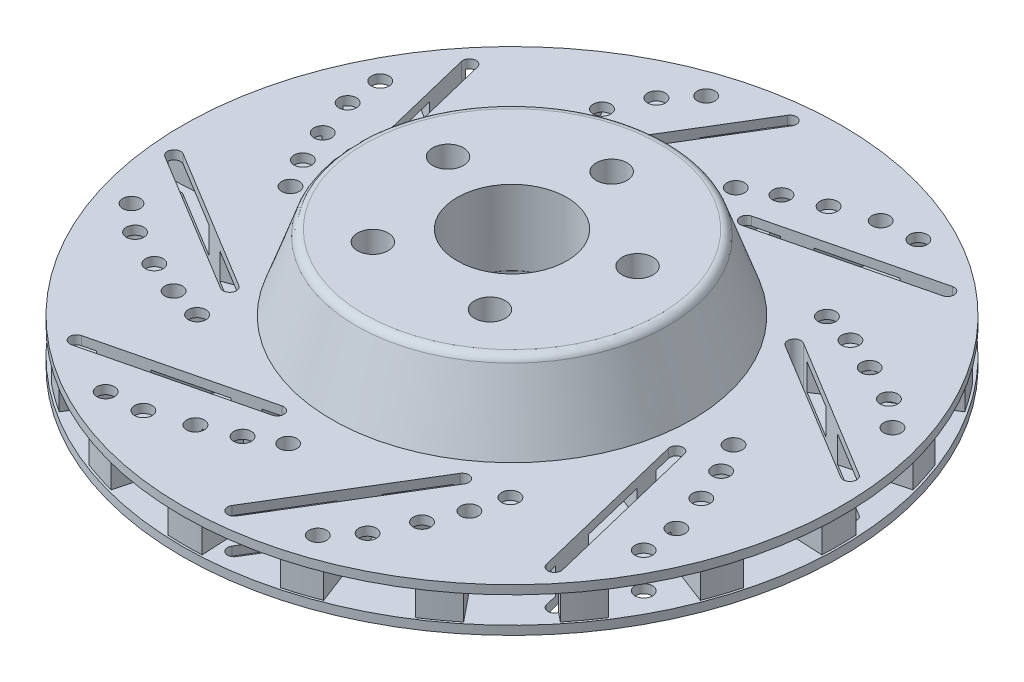
from build123d import *

# Parameters (mm, degrees)
SKETCH1_R               = 150
BOSS_EXTRUDE1_DEPTH     = 4
BOSS_EXTRUDE3_DEPTH     = 12
SKETCH4_R               = 150
BOSS_EXTRUDE4_DEPTH     = 4
FILLET1_R               = 4
SKETCH6_R               = 25
CUT_EXTRUDE1_DEPTH      = 219.919136573
SKETCH7_R               = 7
CUT_EXTRUDE2_DEPTH      = 31
CUT_EXTRUDE3_DEPTH      = 215.853531572
CUT_EXTRUDE3_DEPTH_BACK = 215.853531572
SKETCH9_R               = 4


with BuildPart() as part:
    # Sketch1 → Boss-Extrude1 (new body)
    with BuildSketch(Plane(origin=(0, 0, 0), x_dir=(1, 0, 0), z_dir=(0, 1, 0))):
        with Locations(Location((0, 0, 0), (0, 0, 270))):
            Circle(SKETCH1_R)
    extrude(amount=BOSS_EXTRUDE1_DEPTH)

    # Sketch2 → Boss-Extrude3 (add)
    with BuildSketch(Plane(origin=(0, 4, 0), x_dir=(1, 0, 0), z_dir=(0, 1, 0))):
        with BuildLine():
            Line((-4.291548412, 81.88762185), (-7.79805748, 148.795800678))
            ThreePointArc((-7.79805748, 148.795800678), (0, 149), (7.79805748, 148.795800678))
            Line((7.79805748, 148.795800678), (4.291548412, 81.88762185))
            ThreePointArc((4.291548412, 81.88762185), (0, 82), (-4.291548412, 81.88762185))
        make_face()
        with BuildLine():
            Line((21.223161698, 79.205917756), (38.56403772, 143.922948117))
            ThreePointArc((38.56403772, 143.922948117), (46.043532162, 141.707420928), (53.396824482, 139.103483548))
            Line((53.396824482, 139.103483548), (29.386171863, 76.553594973))
            ThreePointArc((29.386171863, 76.553594973), (25.339393539, 77.986634336), (21.223161698, 79.205917756))
        make_face()
        with BuildLine():
            Line((44.660400871, 68.770986572), (81.151216217, 124.961914624))
            ThreePointArc((81.151216217, 124.961914624), (87.580002592, 120.543532162), (93.768738266, 115.794748257))
            Line((93.768738266, 115.794748257), (51.604272066, 63.725968839))
            ThreePointArc((51.604272066, 63.725968839), (48.198390688, 66.339393539), (44.660400871, 68.770986572))
        make_face()
        with BuildLine():
            Line((63.725968839, 51.604272066), (115.794748257, 93.768738266))
            ThreePointArc((115.794748257, 93.768738266), (120.543532162, 87.580002592), (124.961914624, 81.151216217))
            Line((124.961914624, 81.151216217), (68.770986572, 44.660400871))
            ThreePointArc((68.770986572, 44.660400871), (66.339393539, 48.198390688), (63.725968839, 51.604272066))
        make_face()
        with BuildLine():
            Line((76.553594973, 29.386171863), (139.103483548, 53.396824482))
            ThreePointArc((139.103483548, 53.396824482), (141.707420928, 46.043532162), (143.922948117, 38.56403772))
            Line((143.922948117, 38.56403772), (79.205917756, 21.223161698))
            ThreePointArc((79.205917756, 21.223161698), (77.986634336, 25.339393539), (76.553594973, 29.386171863))
        make_face()
        with BuildLine():
            Line((81.88762185, 4.291548412), (148.795800678, 7.79805748))
            ThreePointArc((148.795800678, 7.79805748), (149, 0), (148.795800678, -7.79805748))
            Line((148.795800678, -7.79805748), (81.88762185, -4.291548412))
            ThreePointArc((81.88762185, -4.291548412), (82, 0), (81.88762185, 4.291548412))
        make_face()
        with BuildLine():
            Line((79.205917756, -21.223161698), (143.922948117, -38.56403772))
            ThreePointArc((143.922948117, -38.56403772), (141.707420928, -46.043532162), (139.103483548, -53.396824482))
            Line((139.103483548, -53.396824482), (76.553594973, -29.386171863))
            ThreePointArc((76.553594973, -29.386171863), (77.986634336, -25.339393539), (79.205917756, -21.223161698))
        make_face()
        with BuildLine():
            Line((68.770986572, -44.660400871), (124.961914624, -81.151216217))
            ThreePointArc((124.961914624, -81.151216217), (120.543532162, -87.580002592), (115.794748257, -93.768738266))
            Line((115.794748257, -93.768738266), (63.725968839, -51.604272066))
            ThreePointArc((63.725968839, -51.604272066), (66.339393539, -48.198390688), (68.770986572, -44.660400871))
        make_face()
        with BuildLine():
            Line((51.604272066, -63.725968839), (93.768738266, -115.794748257))
            ThreePointArc((93.768738266, -115.794748257), (87.580002592, -120.543532162), (81.151216217, -124.961914624))
            Line((81.151216217, -124.961914624), (44.660400871, -68.770986572))
            ThreePointArc((44.660400871, -68.770986572), (48.198390688, -66.339393539), (51.604272066, -63.725968839))
        make_face()
        with BuildLine():
            Line((29.386171863, -76.553594973), (53.396824482, -139.103483548))
            ThreePointArc((53.396824482, -139.103483548), (46.043532162, -141.707420928), (38.56403772, -143.922948117))
            Line((38.56403772, -143.922948117), (21.223161698, -79.205917756))
            ThreePointArc((21.223161698, -79.205917756), (25.339393539, -77.986634336), (29.386171863, -76.553594973))
        make_face()
        with BuildLine():
            Line((4.291548412, -81.88762185), (7.79805748, -148.795800678))
            ThreePointArc((7.79805748, -148.795800678), (0, -149), (-7.79805748, -148.795800678))
            Line((-7.79805748, -148.795800678), (-4.291548412, -81.88762185))
            ThreePointArc((-4.291548412, -81.88762185), (0, -82), (4.291548412, -81.88762185))
        make_face()
        with BuildLine():
            Line((-21.223161698, -79.205917756), (-38.56403772, -143.922948117))
            ThreePointArc((-38.56403772, -143.922948117), (-46.043532162, -141.707420928), (-53.396824482, -139.103483548))
            Line((-53.396824482, -139.103483548), (-29.386171863, -76.553594973))
            ThreePointArc((-29.386171863, -76.553594973), (-25.339393539, -77.986634336), (-21.223161698, -79.205917756))
        make_face()
        with BuildLine():
            Line((-44.660400871, -68.770986572), (-81.151216217, -124.961914624))
            ThreePointArc((-81.151216217, -124.961914624), (-87.580002592, -120.543532162), (-93.768738266, -115.794748257))
            Line((-93.768738266, -115.794748257), (-51.604272066, -63.725968839))
            ThreePointArc((-51.604272066, -63.725968839), (-48.198390688, -66.339393539), (-44.660400871, -68.770986572))
        make_face()
        with BuildLine():
            Line((-63.725968839, -51.604272066), (-115.794748257, -93.768738266))
            ThreePointArc((-115.794748257, -93.768738266), (-120.543532162, -87.580002592), (-124.961914624, -81.151216217))
            Line((-124.961914624, -81.151216217), (-68.770986572, -44.660400871))
            ThreePointArc((-68.770986572, -44.660400871), (-66.339393539, -48.198390688), (-63.725968839, -51.604272066))
        make_face()
        with BuildLine():
            Line((-76.553594973, -29.386171863), (-139.103483548, -53.396824482))
            ThreePointArc((-139.103483548, -53.396824482), (-141.707420928, -46.043532162), (-143.922948117, -38.56403772))
            Line((-143.922948117, -38.56403772), (-79.205917756, -21.223161698))
            ThreePointArc((-79.205917756, -21.223161698), (-77.986634336, -25.339393539), (-76.553594973, -29.386171863))
        make_face()
        with BuildLine():
            Line((-81.88762185, -4.291548412), (-148.795800678, -7.79805748))
            ThreePointArc((-148.795800678, -7.79805748), (-149, 0), (-148.795800678, 7.79805748))
            Line((-148.795800678, 7.79805748), (-81.88762185, 4.291548412))
            ThreePointArc((-81.88762185, 4.291548412), (-82, 0), (-81.88762185, -4.291548412))
        make_face()
        with BuildLine():
            Line((-79.205917756, 21.223161698), (-143.922948117, 38.56403772))
            ThreePointArc((-143.922948117, 38.56403772), (-141.707420928, 46.043532162), (-139.103483548, 53.396824482))
            Line((-139.103483548, 53.396824482), (-76.553594973, 29.386171863))
            ThreePointArc((-76.553594973, 29.386171863), (-77.986634336, 25.339393539), (-79.205917756, 21.223161698))
        make_face()
        with BuildLine():
            Line((-68.770986572, 44.660400871), (-124.961914624, 81.151216217))
            ThreePointArc((-124.961914624, 81.151216217), (-120.543532162, 87.580002592), (-115.794748257, 93.768738266))
            Line((-115.794748257, 93.768738266), (-63.725968839, 51.604272066))
            ThreePointArc((-63.725968839, 51.604272066), (-66.339393539, 48.198390688), (-68.770986572, 44.660400871))
        make_face()
        with BuildLine():
            Line((-51.604272066, 63.725968839), (-93.768738266, 115.794748257))
            ThreePointArc((-93.768738266, 115.794748257), (-87.580002592, 120.543532162), (-81.151216217, 124.961914624))
            Line((-81.151216217, 124.961914624), (-44.660400871, 68.770986572))
            ThreePointArc((-44.660400871, 68.770986572), (-48.198390688, 66.339393539), (-51.604272066, 63.725968839))
        make_face()
        with BuildLine():
            Line((-29.386171863, 76.553594973), (-53.396824482, 139.103483548))
            ThreePointArc((-53.396824482, 139.103483548), (-46.043532162, 141.707420928), (-38.56403772, 143.922948117))
            Line((-38.56403772, 143.922948117), (-21.223161698, 79.205917756))
            ThreePointArc((-21.223161698, 79.205917756), (-25.339393539, 77.986634336), (-29.386171863, 76.553594973))
        make_face()
    extrude(amount=BOSS_EXTRUDE3_DEPTH)

    # Sketch4 → Boss-Extrude4 (add)
    with BuildSketch(Plane(origin=(0, 16, 0), x_dir=(1, 0, 0), z_dir=(0, 1, 0))):
        with Locations(Location((0, 0, 0), (0, 0, 270))):
            Circle(SKETCH4_R)
    extrude(amount=BOSS_EXTRUDE4_DEPTH)


with BuildPart() as body_2:
    # Sketch5 → Revolve1 (revolve)
    with BuildSketch(Plane.XY, mode=Mode.PRIVATE) as revolve1_sk:
        Polygon((0, 20.08870823), (-82, 20), (-70, 54.08870823), (0, 54.08870823), align=None)
    revolve(revolve1_sk.sketch.rotate(Axis((0, 54.08870823, 0), (0, -1, 0)), 90), axis=Axis((0, 54.08870823, 0), (0, -1, 0)))

    # Fillet1
    fillet1_edges = [body_2.edges().sort_by_distance(p)[0] for p in [
        (0, 54.08870823, 70),
    ]]
    fillet(fillet1_edges, radius=FILLET1_R)


with BuildPart() as cut_extrude1_tool:
    # Sketch6 → Cut-Extrude1 (new, through all)
    with BuildSketch(Plane(origin=(0, 54.08870823, 0), x_dir=(1, 0, 0), z_dir=(0, 1, 0))):
        with Locations(Location((0, 0, 0), (0, 0, 270))):
            Circle(SKETCH6_R)
    extrude(amount=-CUT_EXTRUDE1_DEPTH)


with BuildPart() as part_1:
    add(part.part)

    # Cut-Extrude1: cut by cut_extrude1_tool
    add(cut_extrude1_tool.part, mode=Mode.SUBTRACT)

    # Sketch9 → Cut-Extrude3 (cut, two sides: drawn at the far end of the back side and taken through both)
    with BuildSketch(Plane(origin=(0, 20, 0), x_dir=(1, 0, 0), z_dir=(0, 1, 0)).offset(-CUT_EXTRUDE3_DEPTH_BACK)):
        with Locations(Location((-71.300155371, 72.032105656, 0), (0, 0, 270))):
            Circle(SKETCH9_R)
        with Locations(Location((-67.309005618, 86.719536744, 0), (0, 0, 270))):
            Circle(SKETCH9_R)
        with Locations(Location((-60.923166015, 101.885905803, 0), (0, 0, 270))):
            Circle(SKETCH9_R)
        with Locations(Location((-52.907671005, 118.648734763, 0), (0, 0, 270))):
            Circle(SKETCH9_R)
        with Locations(Location((-42.404231164, 130.78183001, 0), (0, 0, 270))):
            Circle(SKETCH9_R)
        with Locations(Location((13.725318186, 108.914626801, 0), (0, 0, 270))):
            Circle(SKETCH9_R)
        with Locations(Location((28.96503108, 115.123398721, 0), (0, 0, 270))):
            Circle(SKETCH9_R)
        with Locations(Location((46.485951986, 121.308697874, 0), (0, 0, 270))):
            Circle(SKETCH9_R)
        with Locations(Location((62.492399449, 122.461038263, 0), (0, 0, 270))):
            Circle(SKETCH9_R)
        with Locations(Location((0.51756701, 101.351213735, 0), (0, 0, 270))):
            Circle(SKETCH9_R)
        with Locations(Location((86.719536744, 67.309005618, 0), (0, 0, 270))):
            Circle(SKETCH9_R)
        with Locations(Location((101.885905803, 60.923166015, 0), (0, 0, 270))):
            Circle(SKETCH9_R)
        with Locations(Location((118.648734763, 52.907671005, 0), (0, 0, 270))):
            Circle(SKETCH9_R)
        with Locations(Location((130.78183001, 42.404231164, 0), (0, 0, 270))):
            Circle(SKETCH9_R)
        with Locations(Location((72.032105656, 71.300155371, 0), (0, 0, 270))):
            Circle(SKETCH9_R)
        with Locations(Location((108.914626801, -13.725318186, 0), (0, 0, 270))):
            Circle(SKETCH9_R)
        with Locations(Location((115.123398721, -28.96503108, 0), (0, 0, 270))):
            Circle(SKETCH9_R)
        with Locations(Location((121.308697874, -46.485951986, 0), (0, 0, 270))):
            Circle(SKETCH9_R)
        with Locations(Location((122.461038263, -62.492399449, 0), (0, 0, 270))):
            Circle(SKETCH9_R)
        with Locations(Location((101.351213735, -0.51756701, 0), (0, 0, 270))):
            Circle(SKETCH9_R)
        with Locations(Location((67.309005618, -86.719536744, 0), (0, 0, 270))):
            Circle(SKETCH9_R)
        with Locations(Location((60.923166015, -101.885905803, 0), (0, 0, 270))):
            Circle(SKETCH9_R)
        with Locations(Location((52.907671005, -118.648734763, 0), (0, 0, 270))):
            Circle(SKETCH9_R)
        with Locations(Location((42.404231164, -130.78183001, 0), (0, 0, 270))):
            Circle(SKETCH9_R)
        with Locations(Location((71.300155371, -72.032105656, 0), (0, 0, 270))):
            Circle(SKETCH9_R)
        with Locations(Location((-13.725318186, -108.914626801, 0), (0, 0, 270))):
            Circle(SKETCH9_R)
        with Locations(Location((-28.96503108, -115.123398721, 0), (0, 0, 270))):
            Circle(SKETCH9_R)
        with Locations(Location((-46.485951986, -121.308697874, 0), (0, 0, 270))):
            Circle(SKETCH9_R)
        with Locations(Location((-62.492399449, -122.461038263, 0), (0, 0, 270))):
            Circle(SKETCH9_R)
        with Locations(Location((-0.51756701, -101.351213735, 0), (0, 0, 270))):
            Circle(SKETCH9_R)
        with Locations(Location((-86.719536744, -67.309005618, 0), (0, 0, 270))):
            Circle(SKETCH9_R)
        with Locations(Location((-101.885905803, -60.923166015, 0), (0, 0, 270))):
            Circle(SKETCH9_R)
        with Locations(Location((-118.648734763, -52.907671005, 0), (0, 0, 270))):
            Circle(SKETCH9_R)
        with Locations(Location((-130.78183001, -42.404231164, 0), (0, 0, 270))):
            Circle(SKETCH9_R)
        with Locations(Location((-72.032105656, -71.300155371, 0), (0, 0, 270))):
            Circle(SKETCH9_R)
        with Locations(Location((-108.914626801, 13.725318186, 0), (0, 0, 270))):
            Circle(SKETCH9_R)
        with Locations(Location((-115.123398721, 28.96503108, 0), (0, 0, 270))):
            Circle(SKETCH9_R)
        with Locations(Location((-121.308697874, 46.485951986, 0), (0, 0, 270))):
            Circle(SKETCH9_R)
        with Locations(Location((-122.461038263, 62.492399449, 0), (0, 0, 270))):
            Circle(SKETCH9_R)
        with Locations(Location((-101.351213735, 0.51756701, 0), (0, 0, 270))):
            Circle(SKETCH9_R)
        with BuildLine():
            Line((-55.498793924, 77.156740316), (-16.277663295, 141.708184477))
            ThreePointArc((-16.277663295, 141.708184477), (-12.11218721, 142.72495423), (-11.095417456, 138.559478144))
            Line((-11.095417456, 138.559478144), (-50.316548085, 74.008033984))
            ThreePointArc((-50.316548085, 74.008033984), (-54.482024171, 72.99126423), (-55.498793924, 77.156740316))
        make_face()
        with BuildLine():
            Line((15.31448076, 93.801627823), (88.692772095, 111.712864291))
            ThreePointArc((88.692772095, 111.712864291), (92.35717327, 109.486392691), (90.13070167, 105.821991517))
            Line((90.13070167, 105.821991517), (16.752410335, 87.910755049))
            ThreePointArc((16.752410335, 87.910755049), (13.08800916, 90.137226649), (15.31448076, 93.801627823))
        make_face()
        with BuildLine():
            Line((77.156740316, 55.498793924), (141.708184477, 16.277663295))
            ThreePointArc((141.708184477, 16.277663295), (142.72495423, 12.11218721), (138.559478144, 11.095417456))
            Line((138.559478144, 11.095417456), (74.008033984, 50.316548085))
            ThreePointArc((74.008033984, 50.316548085), (72.99126423, 54.482024171), (77.156740316, 55.498793924))
        make_face()
        with BuildLine():
            Line((93.801627823, -15.31448076), (111.712864291, -88.692772095))
            ThreePointArc((111.712864291, -88.692772095), (109.486392691, -92.35717327), (105.821991517, -90.13070167))
            Line((105.821991517, -90.13070167), (87.910755049, -16.752410335))
            ThreePointArc((87.910755049, -16.752410335), (90.137226649, -13.08800916), (93.801627823, -15.31448076))
        make_face()
        with BuildLine():
            Line((55.498793924, -77.156740316), (16.277663295, -141.708184477))
            ThreePointArc((16.277663295, -141.708184477), (12.11218721, -142.72495423), (11.095417456, -138.559478144))
            Line((11.095417456, -138.559478144), (50.316548085, -74.008033984))
            ThreePointArc((50.316548085, -74.008033984), (54.482024171, -72.99126423), (55.498793924, -77.156740316))
        make_face()
        with BuildLine():
            Line((-15.31448076, -93.801627823), (-88.692772095, -111.712864291))
            ThreePointArc((-88.692772095, -111.712864291), (-92.35717327, -109.486392691), (-90.13070167, -105.821991517))
            Line((-90.13070167, -105.821991517), (-16.752410335, -87.910755049))
            ThreePointArc((-16.752410335, -87.910755049), (-13.08800916, -90.137226649), (-15.31448076, -93.801627823))
        make_face()
        with BuildLine():
            Line((-77.156740316, -55.498793924), (-141.708184477, -16.277663295))
            ThreePointArc((-141.708184477, -16.277663295), (-142.72495423, -12.11218721), (-138.559478144, -11.095417456))
            Line((-138.559478144, -11.095417456), (-74.008033984, -50.316548085))
            ThreePointArc((-74.008033984, -50.316548085), (-72.99126423, -54.482024171), (-77.156740316, -55.498793924))
        make_face()
        with BuildLine():
            Line((-93.801627823, 15.31448076), (-111.712864291, 88.692772095))
            ThreePointArc((-111.712864291, 88.692772095), (-109.486392691, 92.35717327), (-105.821991517, 90.13070167))
            Line((-105.821991517, 90.13070167), (-87.910755049, 16.752410335))
            ThreePointArc((-87.910755049, 16.752410335), (-90.137226649, 13.08800916), (-93.801627823, 15.31448076))
        make_face()
    extrude(amount=CUT_EXTRUDE3_DEPTH + CUT_EXTRUDE3_DEPTH_BACK, mode=Mode.SUBTRACT)


with BuildPart() as body_2_1:
    add(body_2.part)

    # Cut-Extrude1: cut by cut_extrude1_tool
    add(cut_extrude1_tool.part, mode=Mode.SUBTRACT)

    # Sketch7 → Cut-Extrude2 (cut)
    with BuildSketch(Plane(origin=(0, 54.08870823, 0), x_dir=(1, 0, 0), z_dir=(0, 1, 0))):
        with Locations(Location((0, 45.34943229, 0), (0, 0, 270))):
            Circle(SKETCH7_R)
        with Locations(Location((43.12987309, 14.013745263, 0), (0, 0, 270))):
            Circle(SKETCH7_R)
        with Locations(Location((26.6557275, -36.688461408, 0), (0, 0, 270))):
            Circle(SKETCH7_R)
        with Locations(Location((-26.6557275, -36.688461408, 0), (0, 0, 270))):
            Circle(SKETCH7_R)
        with Locations(Location((-43.12987309, 14.013745263, 0), (0, 0, 270))):
            Circle(SKETCH7_R)
    extrude(amount=-CUT_EXTRUDE2_DEPTH, mode=Mode.SUBTRACT)


solid = Compound([part_1.part, body_2_1.part])
